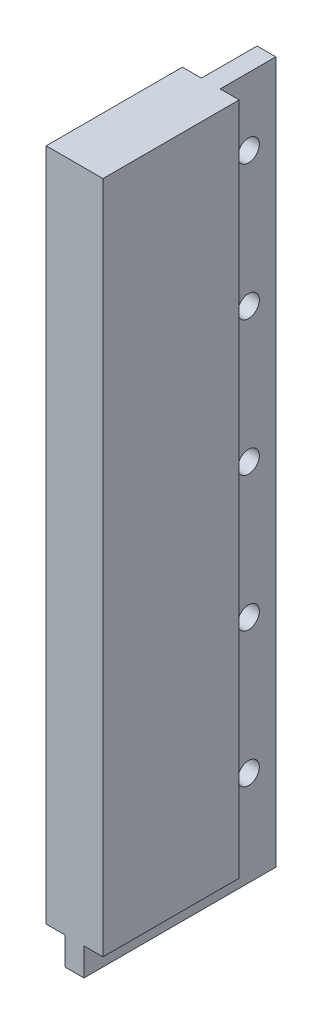
from build123d import *

# Parameters (mm, degrees)
SKETCH1_W           = 118.75
SKETCH1_H           = 24
BOSS_EXTRUDE1_DEPTH = 10
SKETCH2_W           = 3.3
SKETCH2_H           = 9.8
BOSS_EXTRUDE2_DEPTH = 118.75
SKETCH3_W           = 3.3
SKETCH3_H           = 33.8
BOSS_EXTRUDE3_DEPTH = 4.9
CUT_EXTRUDE1_REACH  = 123.333
SKETCH4_R           = 1.9
LPATTERN1_COUNT     = 5
LPATTERN1_PITCH     = 23.75


with BuildPart() as part:
    # Sketch1 → Boss-Extrude1 (new body)
    with BuildSketch(Plane.YZ):
        with Locations((59.375, 12)):
            Rectangle(SKETCH1_W, SKETCH1_H)
    extrude(amount=-BOSS_EXTRUDE1_DEPTH)

    # Sketch2 → Boss-Extrude2 (add, through all)
    with BuildSketch(Plane.XZ):
        with Locations((-5, -4.9)):
            Rectangle(SKETCH2_W, SKETCH2_H)
    extrude(amount=-BOSS_EXTRUDE2_DEPTH)

    # Sketch3 → Boss-Extrude3 (add)
    with BuildSketch(Plane.XZ):
        with Locations((-5, 7.1)):
            Rectangle(SKETCH3_W, SKETCH3_H)
    extrude(amount=BOSS_EXTRUDE3_DEPTH)

    # Sketch4 → Cut-Extrude1 (cut, up to next)
    with BuildSketch(Plane(origin=(-6.65, 0, 0), x_dir=(0, -1, 0), z_dir=(-1, 0, 0)), mode=Mode.PRIVATE) as cut_extrude1_sk1:
        with Locations(Location((-106.875, -5, 0), (0, 0, 90))):
            Circle(SKETCH4_R)
    cut_extrude1_tool1 = extrude(cut_extrude1_sk1.sketch, amount=-CUT_EXTRUDE1_REACH, mode=Mode.PRIVATE) & part.part
    cut_extrude1 = cut_extrude1_tool1.solids().sort_by_distance((-6.65, 106.875, -5))[0]
    add(cut_extrude1, mode=Mode.SUBTRACT)

    # LPattern1: Cut-Extrude1 ×5
    with Locations(*[(0, -i * LPATTERN1_PITCH, 0) for i in range(1, LPATTERN1_COUNT)]):
        add(cut_extrude1, mode=Mode.SUBTRACT)


solid = part.part
